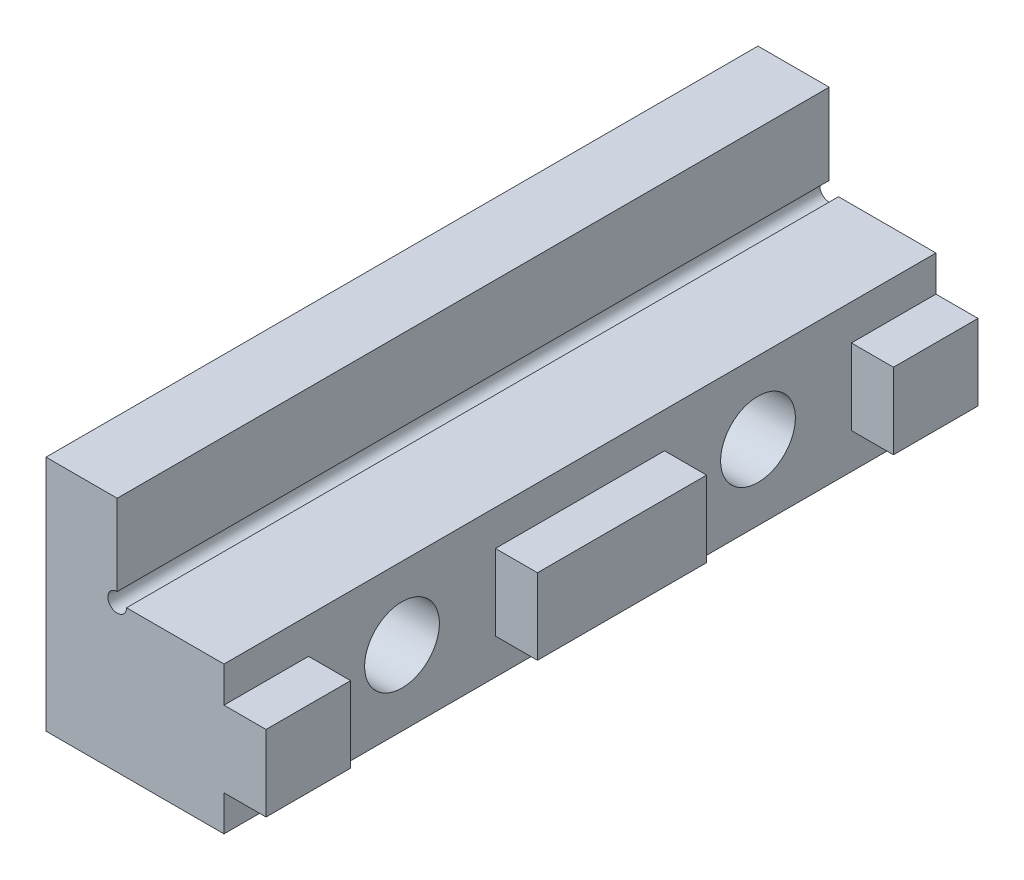
from build123d import *

# Parameters (mm, degrees)
BOSS_EXTRUDE1_DEPTH      = 38.1
BOSS_EXTRUDE1_DEPTH_BACK = 38.1
SKETCH1_W                = 4.5
SKETCH1_H                = 8.12
SKETCH2_R                = 4
CUT_EXTRUDE1_DEPTH       = 55.4
SKETCH3_R                = 6.5
CUT_EXTRUDE2_DEPTH       = 8.2
CUT_EXTRUDE3_START       = 19.05
SKETCH4_W                = 20
SKETCH4_H                = 15
CUT_EXTRUDE3_DEPTH       = 10


with BuildPart() as part:
    # Sketch1 → Boss-Extrude1 (new, two sides: drawn at the far end of the back side and taken through both)
    with BuildSketch(Plane.XY.offset(-BOSS_EXTRUDE1_DEPTH_BACK)):
        with BuildLine():
            ThreePointArc((7.62, 16.748), (6.912893219, 15.040893219), (8.62, 15.748))
            Line((8.62, 15.748), (19.05, 15.748))
            Line((19.05, 15.748), (19.05, 0))
            Line((19.05, 0), (0, 0))
            Line((0, 0), (0, 25.4))
            Line((0, 25.4), (7.62, 25.4))
            Line((7.62, 25.4), (7.62, 16.748))
        make_face()
        with Locations((21.3, 7.874)):
            Rectangle(SKETCH1_W, SKETCH1_H)
    extrude(amount=BOSS_EXTRUDE1_DEPTH + BOSS_EXTRUDE1_DEPTH_BACK)

    # Sketch2 → Cut-Extrude1 (cut)
    with BuildSketch(Plane(origin=(0, 0, 0), x_dir=(0, 0, -1), z_dir=(1, 0, 0))):
        with Locations(Location((-19.05, 8, 0), (0, 0, 100.422660027))):
            Circle(SKETCH2_R)
        with Locations(Location((19.05, 8, 0), (0, 0, 100.422660027))):
            Circle(SKETCH2_R)
    extrude(amount=CUT_EXTRUDE1_DEPTH, mode=Mode.SUBTRACT)

    # Sketch3 → Cut-Extrude2 (cut)
    with BuildSketch(Plane(origin=(0, 0, 0), x_dir=(0, 0, -1), z_dir=(1, 0, 0))):
        with Locations((-19.05, 8)):
            Circle(SKETCH3_R)
        with Locations((19.05, 8)):
            Circle(SKETCH3_R)
    extrude(amount=CUT_EXTRUDE2_DEPTH, mode=Mode.SUBTRACT)

    # Sketch4 → Cut-Extrude3 (cut)
    with BuildSketch(Plane(origin=(0, 0, 0), x_dir=(0, 0, -1), z_dir=(1, 0, 0)).offset(CUT_EXTRUDE3_START)):
        with Locations((-19.05, 8)):
            Rectangle(SKETCH4_W, SKETCH4_H)
        with Locations((19.05, 8)):
            Rectangle(SKETCH4_W, SKETCH4_H)
    extrude(amount=CUT_EXTRUDE3_DEPTH, mode=Mode.SUBTRACT)


solid = part.part
